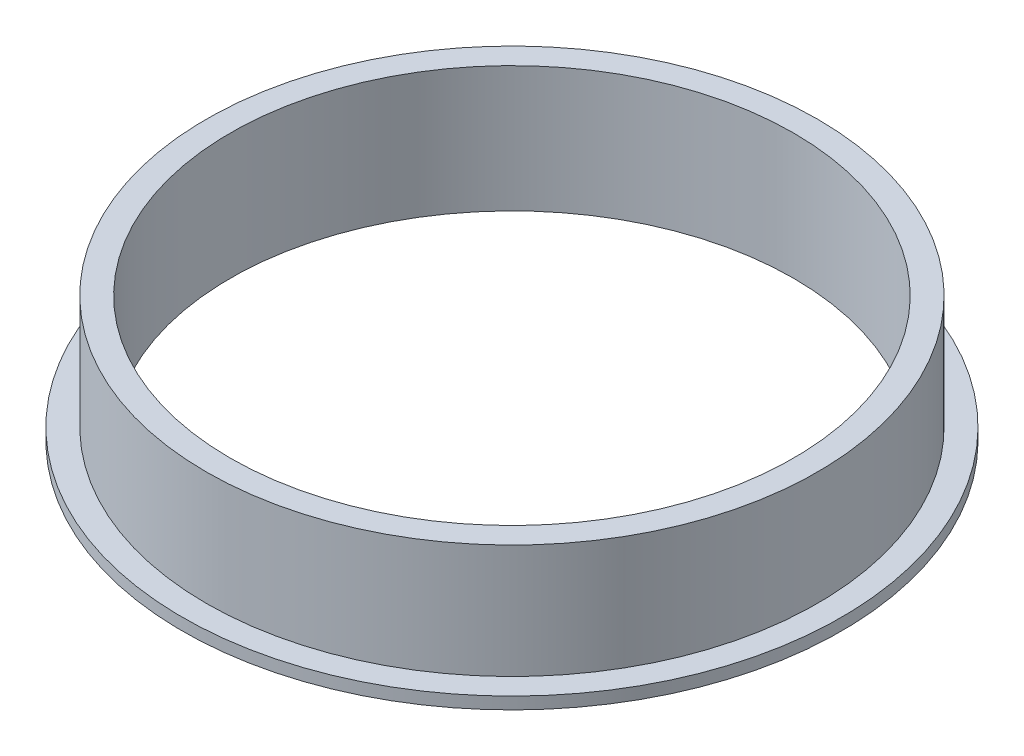
from build123d import *

# Parameters (mm, degrees)
SKETCH1_R           = 25.5
SKETCH1_R_2         = 23.5
EXTRUDE_THIN1_DEPTH = 10.5
EXTRUDE_THIN2_START = -1
SKETCH2_R           = 27.5
SKETCH2_R_2         = 25.5
EXTRUDE_THIN2_DEPTH = 1


with BuildPart() as part:
    # Sketch1 → Extrude-Thin1 (new body)
    with BuildSketch(Plane(origin=(0, 0, 0), x_dir=(1, 0, 0), z_dir=(0, 1, 0))):
        Circle(SKETCH1_R)
        Circle(SKETCH1_R_2, mode=Mode.SUBTRACT)
    extrude(amount=-EXTRUDE_THIN1_DEPTH)

    # Sketch2 → Extrude-Thin2 (add)
    with BuildSketch(Plane(origin=(0, -10.5, 0), x_dir=(-1, 0, 0), z_dir=(0, -1, 0)).offset(EXTRUDE_THIN2_START)):
        Circle(SKETCH2_R)
        Circle(SKETCH2_R_2, mode=Mode.SUBTRACT)
    extrude(amount=EXTRUDE_THIN2_DEPTH)


solid = part.part
